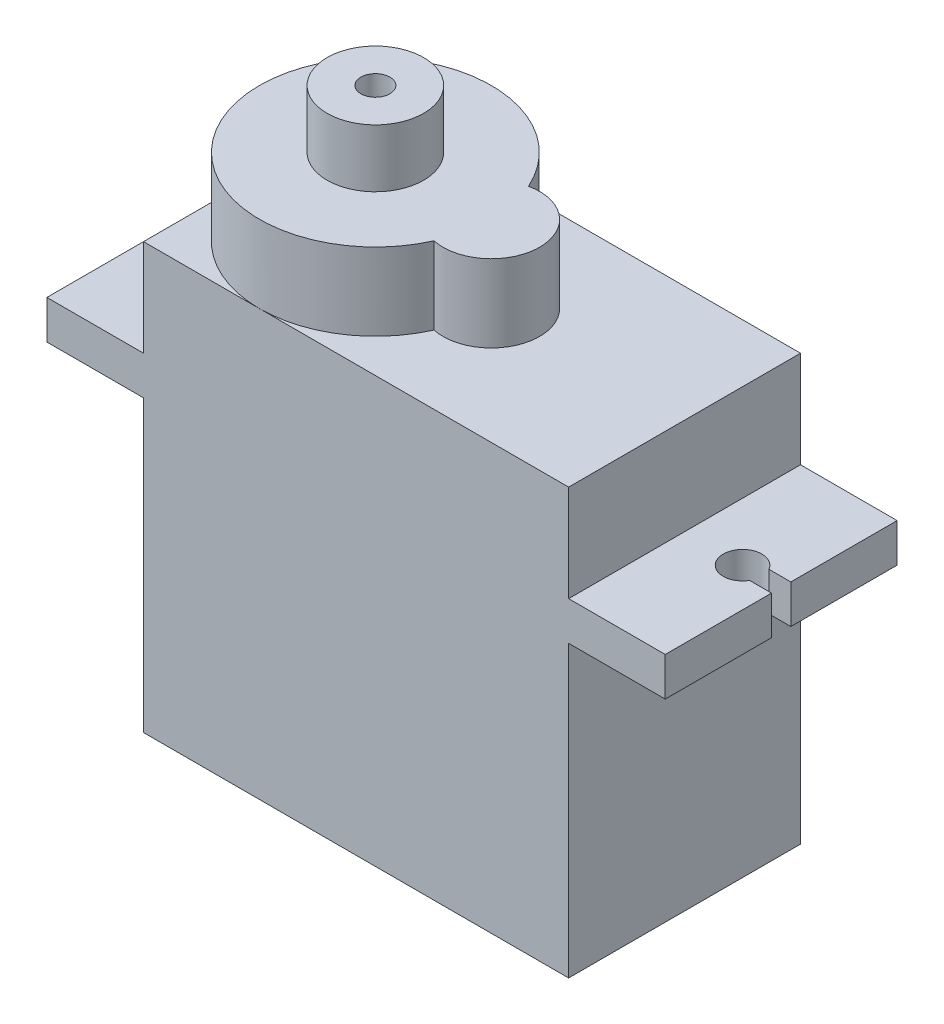
from build123d import *

# Parameters (mm, degrees)
SKETCH1_W           = 22
SKETCH1_H           = 12
BOSS_EXTRUDE1_DEPTH = 22
BOSS_EXTRUDE2_DEPTH = 4
SKETCH3_W           = 5
SKETCH3_H           = 2
BOSS_EXTRUDE3_DEPTH = 12
CUT_EXTRUDE1_REACH  = 26.104
SKETCH5_R           = 2.5
SKETCH5_R_2         = 0.75
BOSS_EXTRUDE4_DEPTH = 3


with BuildPart() as part:
    # Sketch1 → Boss-Extrude1 (new body)
    with BuildSketch(Plane(origin=(0, 0, 0), x_dir=(1, 0, 0), z_dir=(0, 1, 0))):
        Rectangle(SKETCH1_W, SKETCH1_H)
    extrude(amount=BOSS_EXTRUDE1_DEPTH)

    # Sketch2 → Boss-Extrude2 (add)
    with BuildSketch(Plane(origin=(0, 22, 0), x_dir=(1, 0, 0), z_dir=(0, 1, 0))):
        with BuildLine():
            ThreePointArc((0.479166667, 2.445144707), (-11, 0), (0.479166667, -2.445144707))
            ThreePointArc((0.479166667, -2.445144707), (3.5, 0), (0.479166667, 2.445144707))
        make_face()
    extrude(amount=BOSS_EXTRUDE2_DEPTH)

    # Sketch3 → Boss-Extrude3 (add)
    with BuildSketch(Plane.XY.offset(6)):
        with Locations((13.5, 16)):
            Rectangle(SKETCH3_W, SKETCH3_H)
    boss_extrude3 = extrude(amount=-BOSS_EXTRUDE3_DEPTH)

    # Sketch4 → Cut-Extrude1 (cut, up to next)
    with BuildSketch(Plane(origin=(0, 17, 0), x_dir=(1, 0, 0), z_dir=(0, 1, 0)), mode=Mode.PRIVATE) as cut_extrude1_sk1:
        with BuildLine():
            Line((14.866025404, 0.5), (16, 0.5))
            Line((16, 0.5), (16, -0.5))
            Line((16, -0.5), (14.866025404, -0.5))
            ThreePointArc((14.866025404, -0.5), (13, 0), (14.866025404, 0.5))
        make_face()
    cut_extrude1_tool1 = extrude(cut_extrude1_sk1.sketch, amount=-CUT_EXTRUDE1_REACH, mode=Mode.PRIVATE) & part.part
    cut_extrude1 = cut_extrude1_tool1.solids().sort_by_distance((14.368381, 17, 0))[0]
    add(cut_extrude1, mode=Mode.SUBTRACT)

    # Mirror1: Boss-Extrude3, Cut-Extrude1 across plane
    add(boss_extrude3.mirror(Plane(origin=(0, 0, 0), x_dir=(0, 0, 1), z_dir=(1, 0, 0))))
    add(cut_extrude1.mirror(Plane(origin=(0, 0, 0), x_dir=(0, 0, 1), z_dir=(1, 0, 0))), mode=Mode.SUBTRACT)

    # Sketch5 → Boss-Extrude4 (add)
    with BuildSketch(Plane(origin=(0, 26, 0), x_dir=(1, 0, 0), z_dir=(0, 1, 0))):
        with Locations(Location((-5, 0, 0), (0, 0, 270))):
            Circle(SKETCH5_R)
        with Locations(Location((-5, 0, 0), (0, 0, 270))):
            Circle(SKETCH5_R_2, mode=Mode.SUBTRACT)
    extrude(amount=BOSS_EXTRUDE4_DEPTH)


solid = part.part
